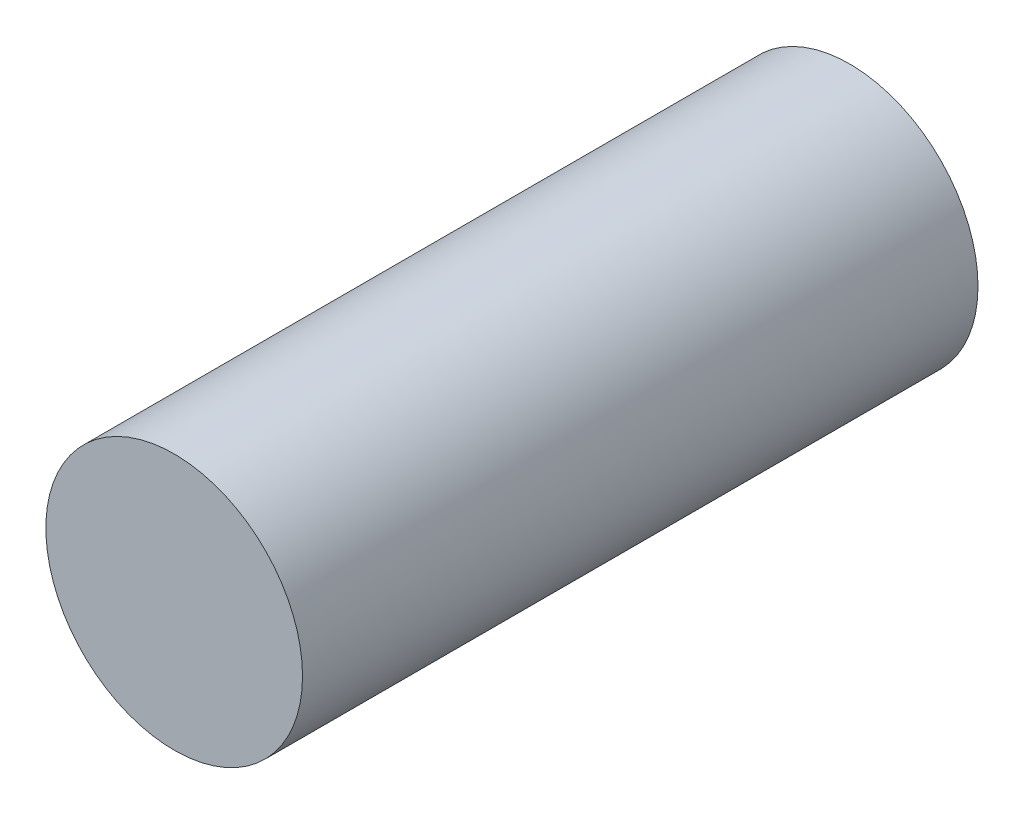
from build123d import *

# Parameters (mm, degrees)
SKETCH1_R           = 1.9
BOSS_EXTRUDE1_DEPTH = 10


with BuildPart() as part:
    # Sketch1 → Boss-Extrude1 (new body)
    with BuildSketch(Plane.XY):
        Circle(SKETCH1_R)
    extrude(amount=BOSS_EXTRUDE1_DEPTH)


solid = part.part
